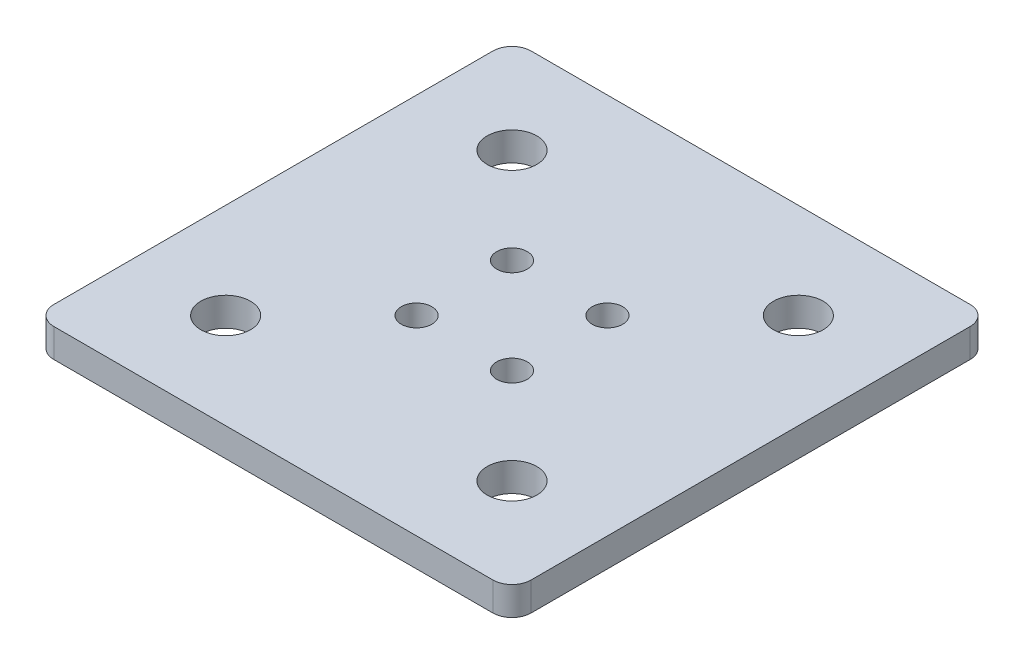
from build123d import *

# Parameters (mm, degrees)
SKETCH_1_W      = 50
SKETCH_1_H      = 50
SKETCH_1_R      = 2.6
SKETCH_1_R_2    = 1.6
EXTRUDE_1_DEPTH = 3
FILLET_1_R      = 2


with BuildPart() as part:
    # 草图1 → 凸台-拉伸1 (new body)
    with BuildSketch(Plane(origin=(0, 0, 0), x_dir=(1, 0, 0), z_dir=(0, 1, 0))):
        Rectangle(SKETCH_1_W, SKETCH_1_H)
        with Locations(Location((-15, 15, 0), (0, 0, 270))):
            Circle(SKETCH_1_R, mode=Mode.SUBTRACT)
        with Locations(Location((-15, -15, 0), (0, 0, 90))):
            Circle(SKETCH_1_R, mode=Mode.SUBTRACT)
        with Locations(Location((15, -15, 0), (0, 0, 270))):
            Circle(SKETCH_1_R, mode=Mode.SUBTRACT)
        with Locations(Location((15, 15, 0), (0, 0, 90))):
            Circle(SKETCH_1_R, mode=Mode.SUBTRACT)
        with Locations(Location((-5, 5, 0), (0, 0, 270))):
            Circle(SKETCH_1_R_2, mode=Mode.SUBTRACT)
        with Locations(Location((-5, -5, 0), (0, 0, 90))):
            Circle(SKETCH_1_R_2, mode=Mode.SUBTRACT)
        with Locations(Location((5, -5, 0), (0, 0, 270))):
            Circle(SKETCH_1_R_2, mode=Mode.SUBTRACT)
        with Locations(Location((5, 5, 0), (0, 0, 90))):
            Circle(SKETCH_1_R_2, mode=Mode.SUBTRACT)
    extrude(amount=EXTRUDE_1_DEPTH)

    # 圆角1
    fillet_1_edges = [part.edges().sort_by_distance(p)[0] for p in [
        (25, 1.5, 25),
        (-25, 1.5, 25),
        (-25, 1.5, -25),
        (25, 1.5, -25),
    ]]
    fillet(fillet_1_edges, radius=FILLET_1_R)


solid = part.part
